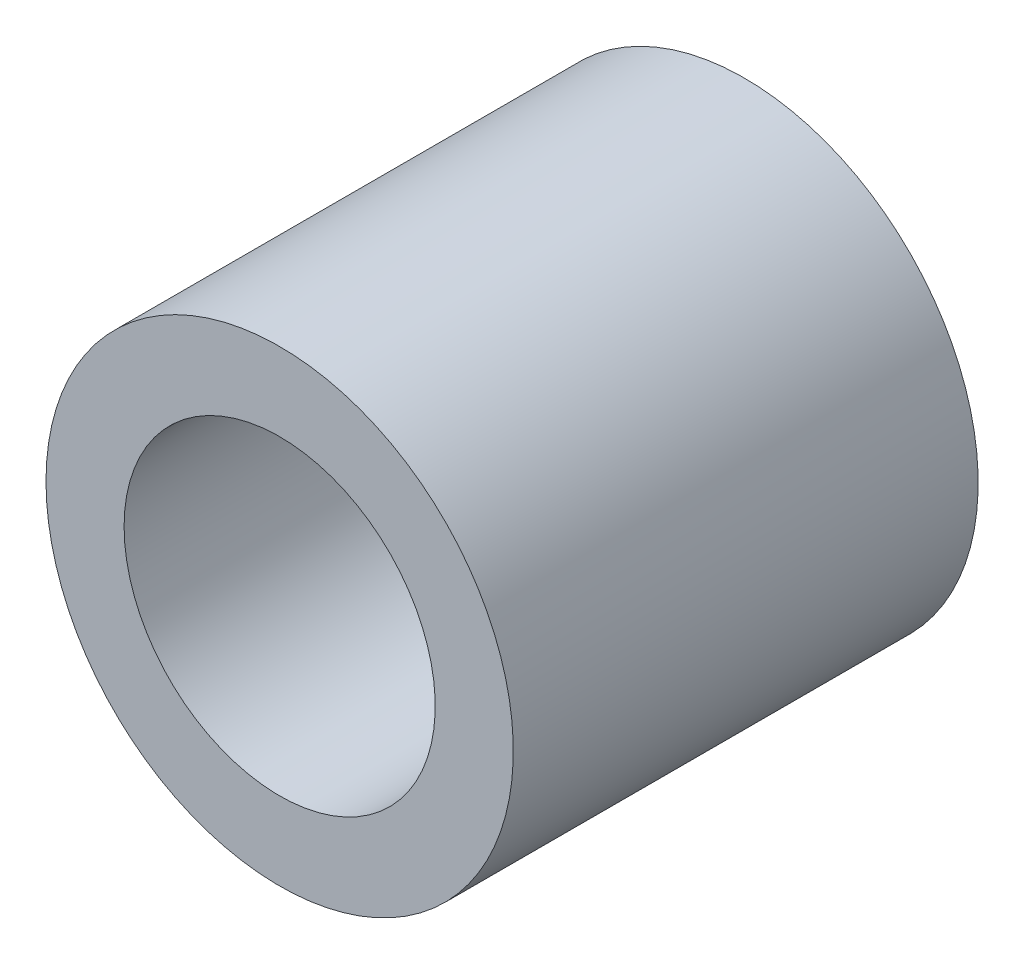
from build123d import *

# Parameters (mm, degrees)
SKETCH1_R      = 4.7879
SKETCH1_R_2    = 3.1877
EXTRUDE1_DEPTH = 4.7625


with BuildPart() as part:
    # Sketch1 → Extrude1 (new, symmetric)
    with BuildSketch(Plane.XY):
        with Locations(Location((0, 0, 0), (0, 0, 180))):
            Circle(SKETCH1_R)
        with Locations(Location((0, 0, 0), (0, 0, 180))):
            Circle(SKETCH1_R_2, mode=Mode.SUBTRACT)
    extrude(amount=EXTRUDE1_DEPTH, both=True)


solid = part.part
